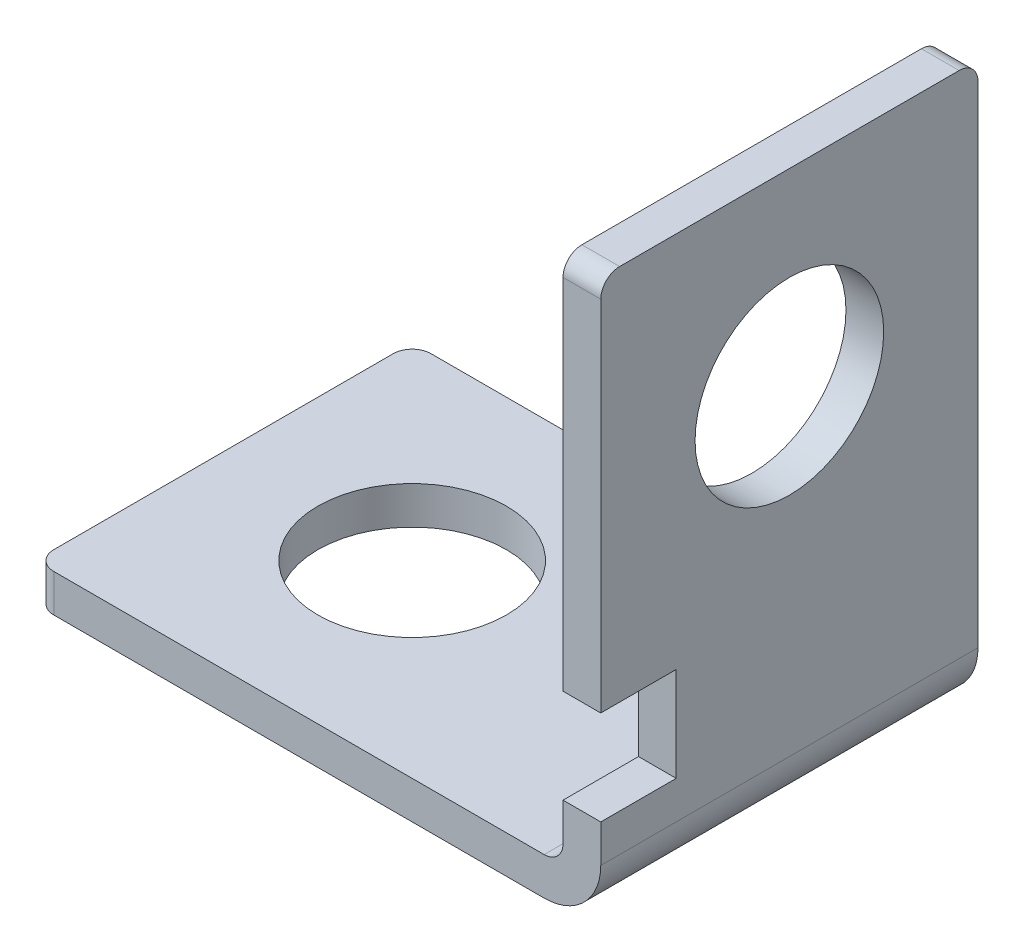
from build123d import *

# Parameters (mm, degrees)
EXTRUDE_THIN1_DEPTH = 20
SKETCH2_R           = 5
SKETCH2_W           = 4
SKETCH2_H           = 5
CUT_EXTRUDE1_DEPTH  = 46.650848842
SKETCH3_R           = 5
CUT_EXTRUDE2_DEPTH  = 46.650848842
FILLET1_R           = 1


with BuildPart() as part:
    # Sketch1 → Extrude-Thin1 (new body)
    with BuildSketch(Plane.XY):
        with BuildLine():
            Line((0, 0), (27, 0))
            ThreePointArc((27, 0), (29.121320344, 0.878679656), (30, 3))
            Line((30, 3), (30, 30))
            Line((30, 30), (28, 30))
            Line((28, 30), (28, 3))
            ThreePointArc((28, 3), (27.707106781, 2.292893219), (27, 2))
            Line((27, 2), (0, 2))
            Line((0, 2), (0, 0))
        make_face()
    extrude(amount=EXTRUDE_THIN1_DEPTH)

    # Sketch2 → Cut-Extrude1 (cut, through all)
    with BuildSketch(Plane.ZY.offset(-28)):
        with Locations((10, 20)):
            Circle(SKETCH2_R)
        with Locations((18, 7.5)):
            Rectangle(SKETCH2_W, SKETCH2_H)
    extrude(amount=-CUT_EXTRUDE1_DEPTH, mode=Mode.SUBTRACT)

    # Sketch3 → Cut-Extrude2 (cut, through all)
    with BuildSketch(Plane(origin=(0, 2, 0), x_dir=(1, 0, 0), z_dir=(0, 1, 0))):
        with Locations(Location((10, -10, 0), (0, 0, 270))):
            Circle(SKETCH3_R)
    extrude(amount=-CUT_EXTRUDE2_DEPTH, mode=Mode.SUBTRACT)

    # Fillet1
    fillet1_edges = [part.edges().sort_by_distance(p)[0] for p in [
        (0, 1, 20),
        (29, 30, 20),
        (0, 1, 0),
        (29, 30, 0),
    ]]
    fillet(fillet1_edges, radius=FILLET1_R)


solid = part.part
